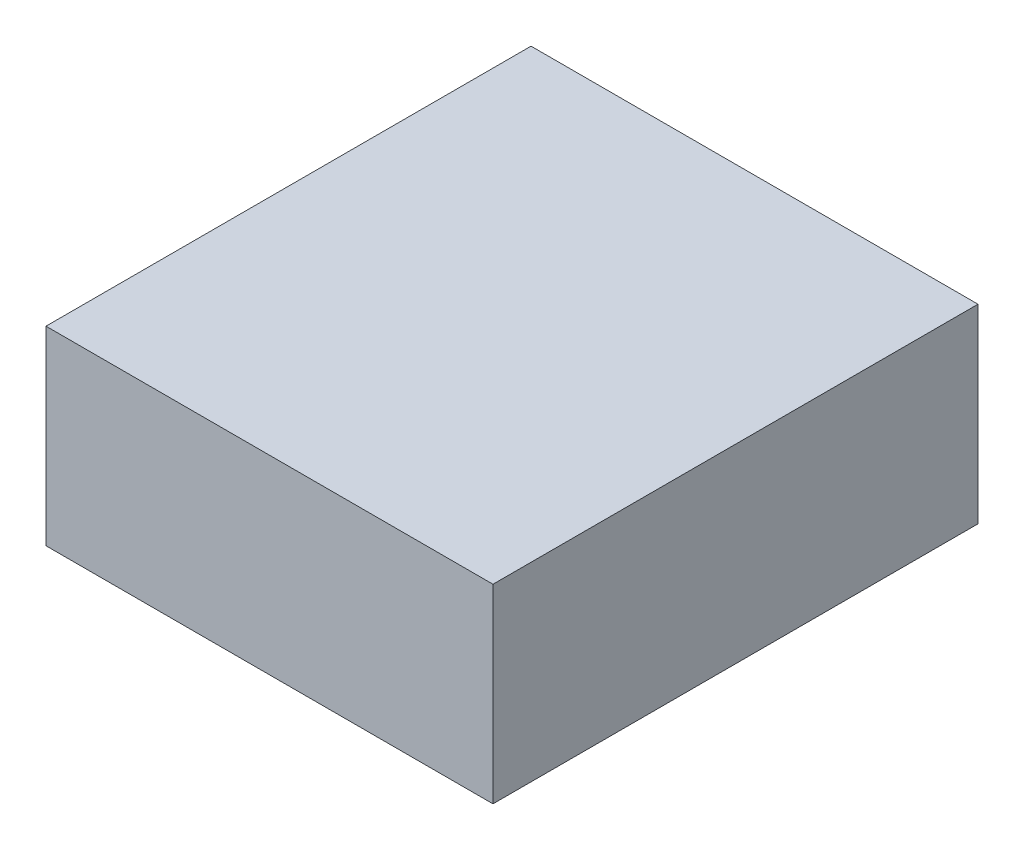
from build123d import *

# Parameters (mm, degrees)
SKETCH1_W           = 47
SKETCH1_H           = 51
BOSS_EXTRUDE1_DEPTH = 20


with BuildPart() as part:
    # Sketch1 → Boss-Extrude1 (new body)
    with BuildSketch(Plane(origin=(0, 0, 0), x_dir=(1, 0, 0), z_dir=(0, 1, 0))):
        Rectangle(SKETCH1_W, SKETCH1_H)
    extrude(amount=BOSS_EXTRUDE1_DEPTH)


solid = part.part
